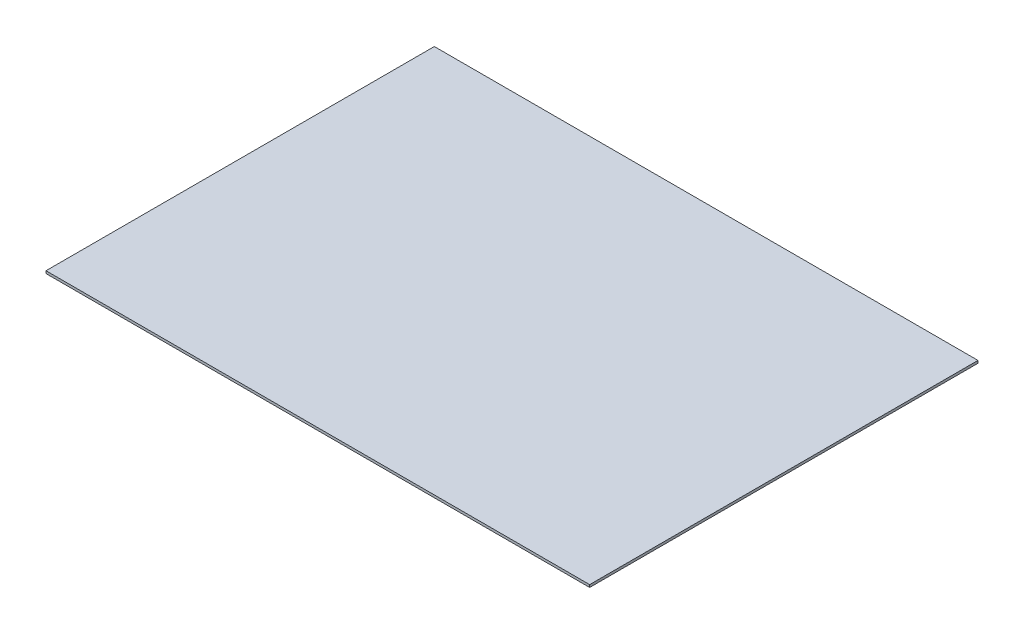
from build123d import *

# Parameters (mm, degrees)
SKETCH1_W           = 700
SKETCH1_H           = 500
BOSS_EXTRUDE1_DEPTH = 3.2


with BuildPart() as part:
    # Sketch1 → Boss-Extrude1 (new body)
    with BuildSketch(Plane(origin=(0, 0, 0), x_dir=(1, 0, 0), z_dir=(0, 1, 0))):
        Rectangle(SKETCH1_W, SKETCH1_H)
    extrude(amount=BOSS_EXTRUDE1_DEPTH)


solid = part.part
